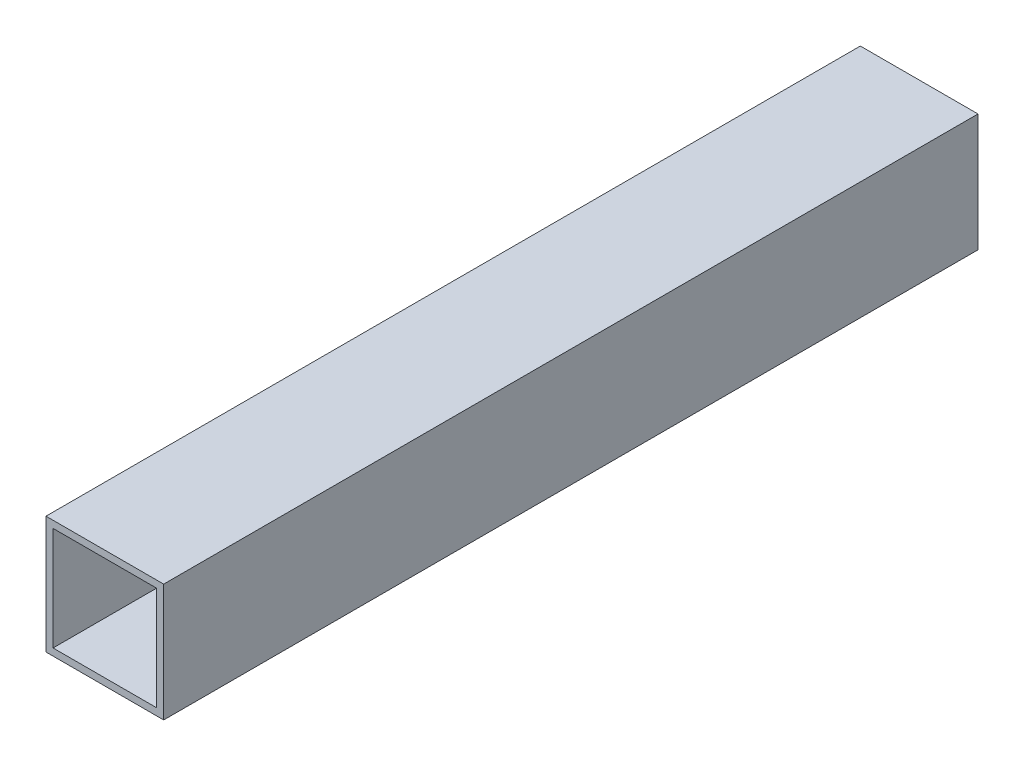
from build123d import *

# Parameters (mm, degrees)
SKIZZE1_W                    = 25
SKIZZE1_H                    = 25
SKIZZE1_W_2                  = 22
SKIZZE1_H_2                  = 22
LINEAR_AUSTRAGEN_D_NN1_DEPTH = 173


with BuildPart() as part:
    # Skizze1 → Linear-Austragen-Dünn1 (new body)
    with BuildSketch(Plane.XY):
        Rectangle(SKIZZE1_W, SKIZZE1_H)
        Rectangle(SKIZZE1_W_2, SKIZZE1_H_2, mode=Mode.SUBTRACT)
    extrude(amount=LINEAR_AUSTRAGEN_D_NN1_DEPTH)


solid = part.part
